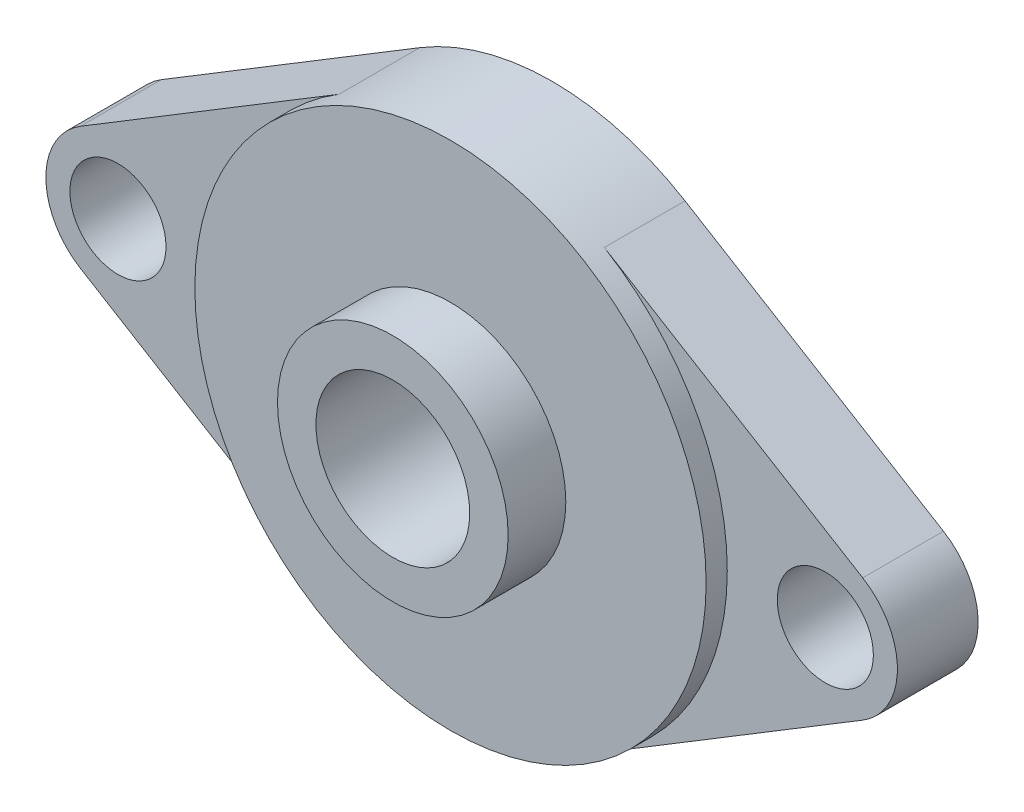
from build123d import *

# Parameters (mm, degrees)
SKETCH_1_R          = 2.5
SKETCH_1_R_2        = 4
EXTRUDE_1_DEPTH     = 4.2
SKETCH_1_3_R        = 4
EXTRUDE_2_DEPTH     = 8.3
CUT_EXTRUDE_START   = -3
SKETCH_2_R          = 13.3
SKETCH_2_R_2        = 6
CUT_EXTRUDE_1_DEPTH = 3


with BuildPart() as part:
    # 草图1 → 凸台-拉伸1 (new body)
    with BuildSketch(Plane.XY):
        with BuildLine():
            Line((20.346331522, 3.205353897), (6.90298913, 11.368321823))
            ThreePointArc((6.90298913, 11.368321823), (0, 13.3), (-6.90298913, 11.368321823))
            Line((-6.90298913, 11.368321823), (-20.346331522, 3.205353897))
            ThreePointArc((-20.346331522, 3.205353897), (-22.15, 0), (-20.346331522, -3.205353897))
            Line((-20.346331522, -3.205353897), (-6.90298913, -11.368321823))
            ThreePointArc((-6.90298913, -11.368321823), (0, -13.3), (6.90298913, -11.368321823))
            Line((6.90298913, -11.368321823), (20.346331522, -3.205353897))
            ThreePointArc((20.346331522, -3.205353897), (22.15, 0), (20.346331522, 3.205353897))
        make_face()
        with Locations((18.4, 0)):
            Circle(SKETCH_1_R, mode=Mode.SUBTRACT)
        Circle(SKETCH_1_R_2, mode=Mode.SUBTRACT)
        with Locations((-18.4, 0)):
            Circle(SKETCH_1_R, mode=Mode.SUBTRACT)
    extrude(amount=EXTRUDE_1_DEPTH)

    # 草图1<3> → 凸台-拉伸2 (add)
    with BuildSketch(Plane.XY):
        with BuildLine():
            ThreePointArc((13.3, 0), (11.590939467, 6.522278918), (6.90298913, 11.368321823))
            ThreePointArc((6.90298913, 11.368321823), (0, 13.3), (-6.90298913, 11.368321823))
            ThreePointArc((-6.90298913, 11.368321823), (-13.3, 0), (-6.90298913, -11.368321823))
            ThreePointArc((-6.90298913, -11.368321823), (0, -13.3), (6.90298913, -11.368321823))
            ThreePointArc((6.90298913, -11.368321823), (11.590939467, -6.522278918), (13.3, 0))
        make_face()
        Circle(SKETCH_1_3_R, mode=Mode.SUBTRACT)
    extrude(amount=EXTRUDE_2_DEPTH)

    # 草图2 → 切除-拉伸1 (cut)
    with BuildSketch(Plane.XY.offset(8.3).offset(CUT_EXTRUDE_START)):
        Circle(SKETCH_2_R)
        Circle(SKETCH_2_R_2, mode=Mode.SUBTRACT)
    extrude(amount=CUT_EXTRUDE_1_DEPTH, mode=Mode.SUBTRACT)


solid = part.part
